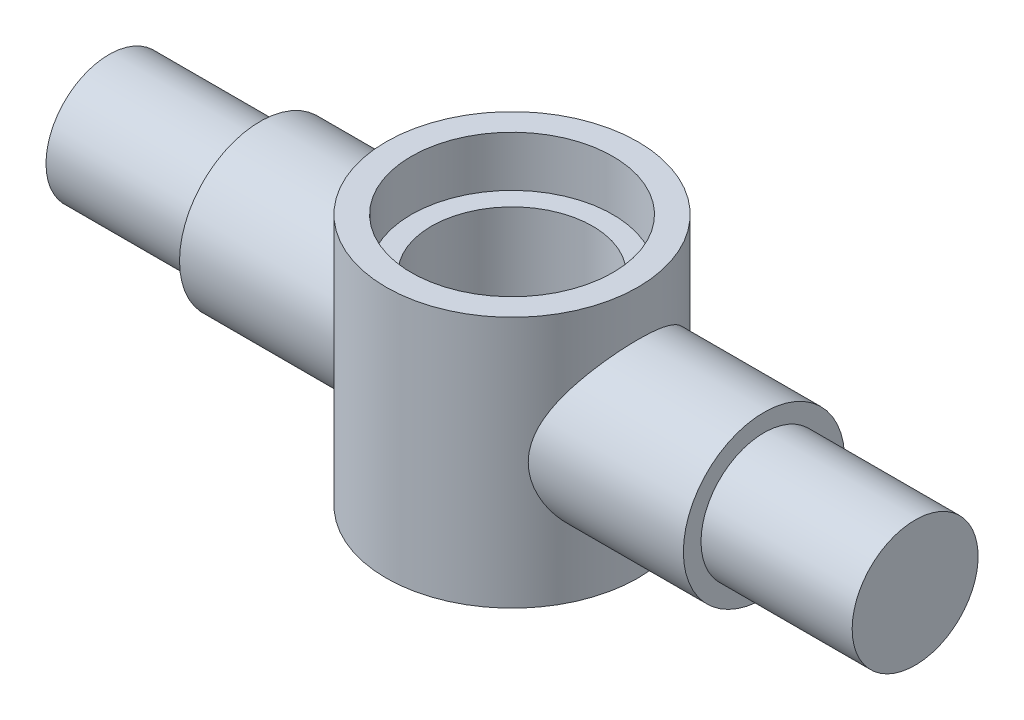
from build123d import *

# Parameters (mm, degrees)
SKETCH1_W = 25
SKETCH1_H = 50


with BuildPart() as part:
    # Sketch1 → Revolve1 (revolve)
    with BuildSketch(Plane.XY, mode=Mode.PRIVATE) as revolve1_sk:
        with Locations((12.5, 0)):
            Rectangle(SKETCH1_W, SKETCH1_H)
    revolve(revolve1_sk.sketch.rotate(Axis((0, 25, 0), (0, -1, 0)), 180), axis=Axis((0, 25, 0), (0, -1, 0)))

    # Sketch2 → Revolve2 (revolve)
    with BuildSketch(Plane.XY, mode=Mode.PRIVATE) as revolve2_sk:
        Polygon((-80, 0), (80, 0), (80, 12.5), (50, 12.5), (50, 16), (-50, 16), (-50, 12.5), (-80, 12.5), align=None)
    revolve(revolve2_sk.sketch.rotate(Axis((-80, 0, 0), (1, 0, 0)), 90), axis=Axis((-80, 0, 0), (1, 0, 0)))

    # Sketch3 → Cut-Revolve1 (revolve, cut)
    with BuildSketch(Plane.XY, mode=Mode.PRIVATE) as cut_revolve1_sk:
        Polygon((0, 25), (0, -25), (16, -25), (16, 15), (20, 15), (20, 25), align=None)
    revolve(cut_revolve1_sk.sketch.rotate(Axis((0, 25, 0), (0, -1, 0)), 180), axis=Axis((0, 25, 0), (0, -1, 0)), mode=Mode.SUBTRACT)


solid = part.part
